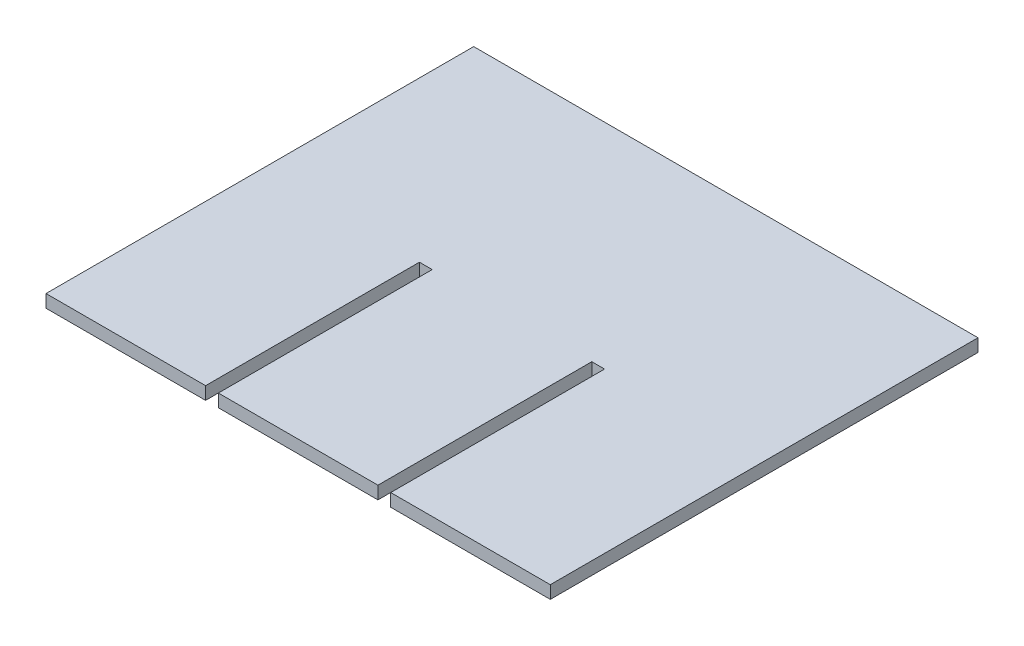
from build123d import *

# Parameters (mm, degrees)
SKETCH1_W           = 79
SKETCH1_H           = 67
BOSS_EXTRUDE1_DEPTH = 2
SKETCH2_W           = 2
SKETCH2_H           = 33.5
CUT_EXTRUDE1_DEPTH  = 52.83145763


with BuildPart() as part:
    # Sketch1 → Boss-Extrude1 (new body)
    with BuildSketch(Plane(origin=(0, 0, 0), x_dir=(1, 0, 0), z_dir=(0, 1, 0))):
        Rectangle(SKETCH1_W, SKETCH1_H)
    extrude(amount=BOSS_EXTRUDE1_DEPTH)

    # Sketch2 → Cut-Extrude1 (cut, through all)
    with BuildSketch(Plane(origin=(0, 2, 0), x_dir=(1, 0, 0), z_dir=(0, 1, 0))):
        with Locations((-13.5, -16.75)):
            Rectangle(SKETCH2_W, SKETCH2_H)
        with Locations((13.5, -16.75)):
            Rectangle(SKETCH2_W, SKETCH2_H)
    extrude(amount=-CUT_EXTRUDE1_DEPTH, mode=Mode.SUBTRACT)


solid = part.part
